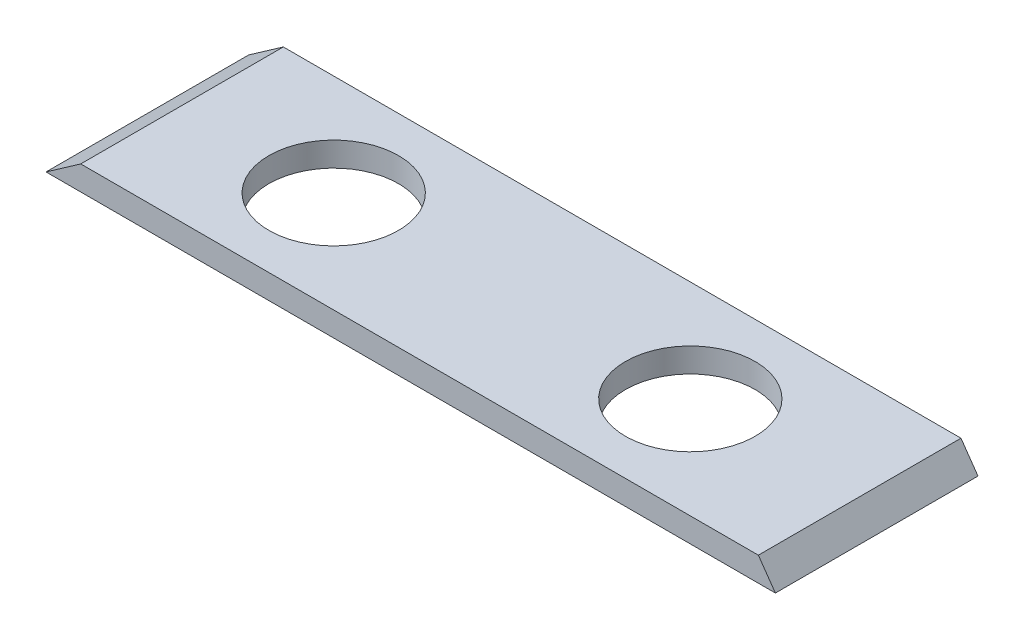
from build123d import *

# Parameters (mm, degrees)
EXTRUDE_1_DEPTH     = 25
SKETCH_3_R          = 8
CUT_EXTRUDE_2_DEPTH = 52.565492337


with BuildPart() as part:
    # Эскиз2 → Бобышка-Вытянуть1 (new body)
    with BuildSketch(Plane.XY):
        Polygon((-45, 0), (45, 0), (42.899377385, 3), (-40.71555598, 3), align=None)
    extrude(amount=EXTRUDE_1_DEPTH)

    # Эскиз3 → Вырез-Вытянуть2 (cut, through all)
    with BuildSketch(Plane(origin=(0, 3, 0), x_dir=(1, 0, 0), z_dir=(0, 1, 0))):
        with Locations(Location((-22, -12.5, 0), (0, 0, 180))):
            Circle(SKETCH_3_R)
        with Locations(Location((22, -12.5, 0), (0, 0, 180))):
            Circle(SKETCH_3_R)
    extrude(amount=-CUT_EXTRUDE_2_DEPTH, mode=Mode.SUBTRACT)


solid = part.part
